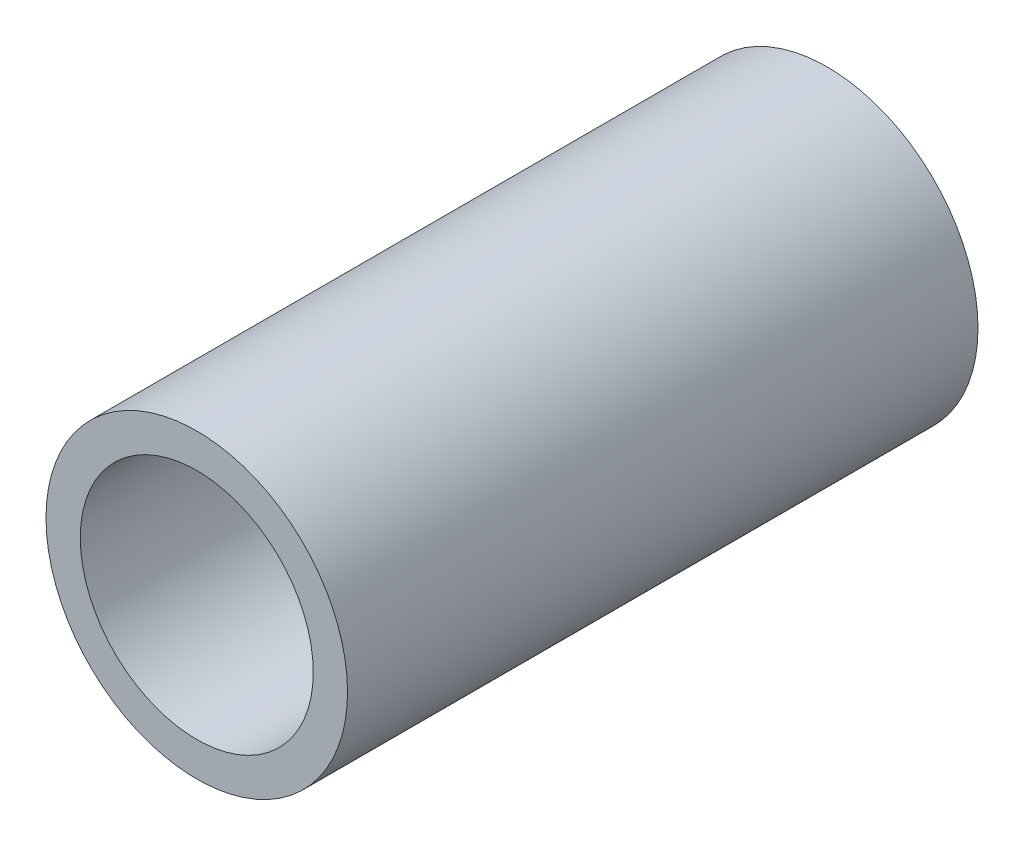
from build123d import *

# Parameters (mm, degrees)
CROQUIS1_R              = 5.5
CROQUIS1_R_2            = 4.25
SALIENTE_EXTRUIR1_DEPTH = 23


with BuildPart() as part:
    # Croquis1 → Saliente-Extruir1 (new body)
    with BuildSketch(Plane.XY):
        Circle(CROQUIS1_R)
        Circle(CROQUIS1_R_2, mode=Mode.SUBTRACT)
    extrude(amount=SALIENTE_EXTRUIR1_DEPTH)


solid = part.part
